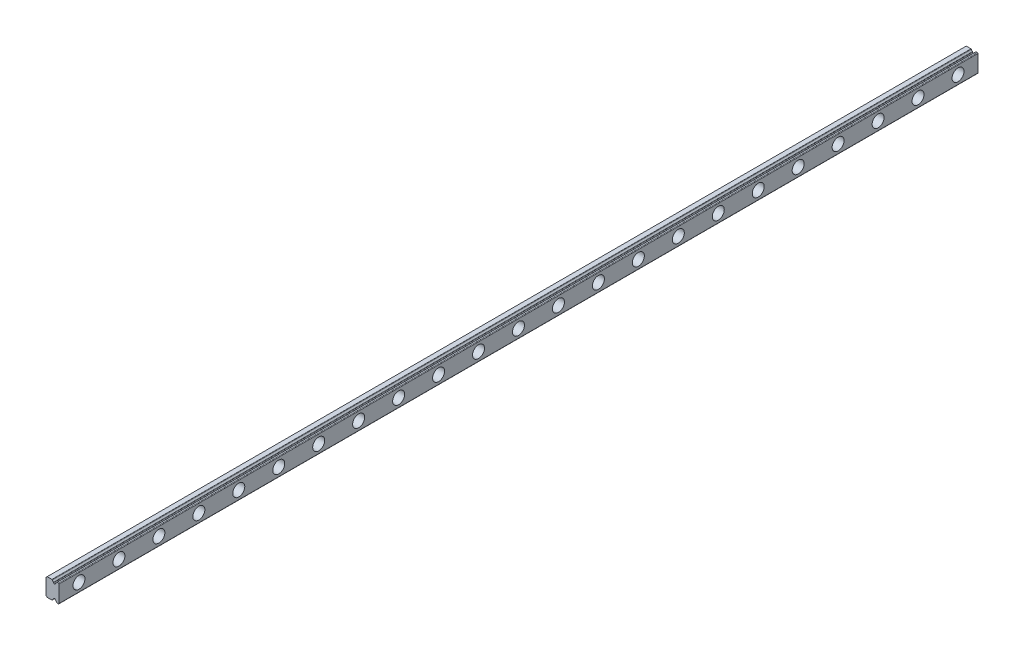
from build123d import *

# Parameters (mm, degrees)
EXTRUDE_1_DEPTH      = 400
SKETCH_2_R           = 3
CUT_EXTRUDE_1_DEPTH  = 4.5
SKETCH_3_R           = 1.75
CUT_EXTRUDE_2_DEPTH  = 401.126542484
CUT_EXTRUDE_4_DEPTH  = 80
EXTRUDE_2_DEPTH      = 200
CUT_EXTRUDE_START    = -100
SKETCH_7_R           = 1.75
CUT_EXTRUDE_5_DEPTH  = 100
SKETCH_8_R           = 3
CUT_EXTRUDE_6_DEPTH  = 4.5
CUT_EXTRUDE_10_DEPTH = 60


with BuildPart() as part:
    # 草图1 → 凸台-拉伸1 (new body)
    with BuildSketch(Plane.XY):
        with BuildLine():
            ThreePointArc((6.2, 9), (6.412132034, 8.912132034), (6.5, 8.7))
            Line((6.5, 8.7), (6.5, 0.3))
            ThreePointArc((6.5, 0.3), (6.412132034, 0.087867966), (6.2, 0))
            Line((6.2, 0), (5.557669683, 0))
            ThreePointArc((5.557669683, 0), (5.444280341, 0.035249106), (5.370859728, 0.128571429))
            ThreePointArc((5.370859728, 0.128571429), (5.130846451, 0.514929157), (4.764285714, 0.784209483))
            ThreePointArc((4.764285714, 0.784209483), (4.680969149, 0.858006567), (4.65, 0.964911064))
            Line((4.65, 0.964911064), (4.65, 1))
            ThreePointArc((4.65, 1), (4.25, 1.4), (3.85, 1))
            Line((3.85, 1), (3.85, 0.964911064))
            ThreePointArc((3.85, 0.964911064), (3.819030851, 0.858006567), (3.735714286, 0.784209483))
            ThreePointArc((3.735714286, 0.784209483), (3.369153549, 0.514929157), (3.129140272, 0.128571429))
            ThreePointArc((3.129140272, 0.128571429), (3.055719659, 0.035249106), (2.942330317, 0))
            Line((2.942330317, 0), (0.6, 0))
            Line((0.6, 0), (0, 0.6))
            Line((0, 0.6), (0, 8.4))
            Line((0, 8.4), (0.6, 9))
            Line((0.6, 9), (2.942330317, 9))
            ThreePointArc((2.942330317, 9), (3.055719659, 8.964750894), (3.129140272, 8.871428571))
            ThreePointArc((3.129140272, 8.871428571), (3.369153549, 8.485070843), (3.735714286, 8.215790517))
            ThreePointArc((3.735714286, 8.215790517), (3.819030851, 8.141993433), (3.85, 8.035088936))
            Line((3.85, 8.035088936), (3.85, 8))
            ThreePointArc((3.85, 8), (4.25, 7.6), (4.65, 8))
            Line((4.65, 8), (4.65, 8.035088936))
            ThreePointArc((4.65, 8.035088936), (4.680969149, 8.141993433), (4.764285714, 8.215790517))
            ThreePointArc((4.764285714, 8.215790517), (5.130846451, 8.485070843), (5.370859728, 8.871428571))
            ThreePointArc((5.370859728, 8.871428571), (5.444280341, 8.964750894), (5.557669683, 9))
            Line((5.557669683, 9), (6.2, 9))
        make_face()
    extrude(amount=EXTRUDE_1_DEPTH)

    # 草图2 → 切除-拉伸1 (cut)
    with BuildSketch(Plane(origin=(6.5, 0, 0), x_dir=(0, 0, -1), z_dir=(1, 0, 0))):
        with Locations((-10, 4.5)):
            Circle(SKETCH_2_R)
        with Locations((-30, 4.5)):
            Circle(SKETCH_2_R)
        with Locations((-50, 4.5)):
            Circle(SKETCH_2_R)
        with Locations((-70, 4.5)):
            Circle(SKETCH_2_R)
        with Locations((-90, 4.5)):
            Circle(SKETCH_2_R)
        with Locations((-110, 4.5)):
            Circle(SKETCH_2_R)
        with Locations((-130, 4.5)):
            Circle(SKETCH_2_R)
        with Locations((-150, 4.5)):
            Circle(SKETCH_2_R)
        with Locations((-170, 4.5)):
            Circle(SKETCH_2_R)
        with Locations((-190, 4.5)):
            Circle(SKETCH_2_R)
        with Locations((-210, 4.5)):
            Circle(SKETCH_2_R)
        with Locations((-230, 4.5)):
            Circle(SKETCH_2_R)
        with Locations((-250, 4.5)):
            Circle(SKETCH_2_R)
        with Locations((-270, 4.5)):
            Circle(SKETCH_2_R)
        with Locations((-290, 4.5)):
            Circle(SKETCH_2_R)
        with Locations((-310, 4.5)):
            Circle(SKETCH_2_R)
        with Locations((-330, 4.5)):
            Circle(SKETCH_2_R)
        with Locations((-350, 4.5)):
            Circle(SKETCH_2_R)
        with Locations((-370, 4.5)):
            Circle(SKETCH_2_R)
        with Locations((-390, 4.5)):
            Circle(SKETCH_2_R)
        with Locations((-410, 4.5)):
            Circle(SKETCH_2_R)
        with Locations((-430, 4.5)):
            Circle(SKETCH_2_R)
        with Locations((-450, 4.5)):
            Circle(SKETCH_2_R)
        with Locations((-470, 4.5)):
            Circle(SKETCH_2_R)
        with Locations((-490, 4.5)):
            Circle(SKETCH_2_R)
        with Locations((-510, 4.5)):
            Circle(SKETCH_2_R)
        with Locations((-530, 4.5)):
            Circle(SKETCH_2_R)
        with Locations((-550, 4.5)):
            Circle(SKETCH_2_R)
        with Locations((-570, 4.5)):
            Circle(SKETCH_2_R)
        with Locations((-590, 4.5)):
            Circle(SKETCH_2_R)
        with Locations((-610, 4.5)):
            Circle(SKETCH_2_R)
        with Locations((-630, 4.5)):
            Circle(SKETCH_2_R)
        with Locations((-650, 4.5)):
            Circle(SKETCH_2_R)
        with Locations((-670, 4.5)):
            Circle(SKETCH_2_R)
        with Locations((-690, 4.5)):
            Circle(SKETCH_2_R)
        with Locations((-710, 4.5)):
            Circle(SKETCH_2_R)
        with Locations((-730, 4.5)):
            Circle(SKETCH_2_R)
        with Locations((-750, 4.5)):
            Circle(SKETCH_2_R)
        with Locations((-770, 4.5)):
            Circle(SKETCH_2_R)
        with Locations((-790, 4.5)):
            Circle(SKETCH_2_R)
        with Locations((-810, 4.5)):
            Circle(SKETCH_2_R)
        with Locations((-830, 4.5)):
            Circle(SKETCH_2_R)
        with Locations((-850, 4.5)):
            Circle(SKETCH_2_R)
        with Locations((-870, 4.5)):
            Circle(SKETCH_2_R)
        with Locations((-890, 4.5)):
            Circle(SKETCH_2_R)
        with Locations((-910, 4.5)):
            Circle(SKETCH_2_R)
        with Locations((-930, 4.5)):
            Circle(SKETCH_2_R)
        with Locations((-950, 4.5)):
            Circle(SKETCH_2_R)
        with Locations((-970, 4.5)):
            Circle(SKETCH_2_R)
        with Locations((-990, 4.5)):
            Circle(SKETCH_2_R)
        with Locations((-1010, 4.5)):
            Circle(SKETCH_2_R)
        with Locations((-1030, 4.5)):
            Circle(SKETCH_2_R)
        with Locations((-1050, 4.5)):
            Circle(SKETCH_2_R)
        with Locations((-1070, 4.5)):
            Circle(SKETCH_2_R)
        with Locations((-1090, 4.5)):
            Circle(SKETCH_2_R)
        with Locations((-1110, 4.5)):
            Circle(SKETCH_2_R)
        with Locations((-1130, 4.5)):
            Circle(SKETCH_2_R)
        with Locations((-1150, 4.5)):
            Circle(SKETCH_2_R)
        with Locations((-1170, 4.5)):
            Circle(SKETCH_2_R)
        with Locations((-1190, 4.5)):
            Circle(SKETCH_2_R)
        with Locations((-1210, 4.5)):
            Circle(SKETCH_2_R)
        with Locations((-1230, 4.5)):
            Circle(SKETCH_2_R)
        with Locations((-1250, 4.5)):
            Circle(SKETCH_2_R)
        with Locations((-1270, 4.5)):
            Circle(SKETCH_2_R)
        with Locations((-1290, 4.5)):
            Circle(SKETCH_2_R)
        with Locations((-1310, 4.5)):
            Circle(SKETCH_2_R)
        with Locations((-1330, 4.5)):
            Circle(SKETCH_2_R)
        with Locations((-1350, 4.5)):
            Circle(SKETCH_2_R)
        with Locations((-1370, 4.5)):
            Circle(SKETCH_2_R)
        with Locations((-1390, 4.5)):
            Circle(SKETCH_2_R)
        with Locations((-1410, 4.5)):
            Circle(SKETCH_2_R)
        with Locations((-1430, 4.5)):
            Circle(SKETCH_2_R)
        with Locations((-1450, 4.5)):
            Circle(SKETCH_2_R)
        with Locations((-1470, 4.5)):
            Circle(SKETCH_2_R)
        with Locations((-1490, 4.5)):
            Circle(SKETCH_2_R)
        with Locations((-1510, 4.5)):
            Circle(SKETCH_2_R)
        with Locations((-1530, 4.5)):
            Circle(SKETCH_2_R)
        with Locations((-1550, 4.5)):
            Circle(SKETCH_2_R)
        with Locations((-1570, 4.5)):
            Circle(SKETCH_2_R)
        with Locations((-1590, 4.5)):
            Circle(SKETCH_2_R)
        with Locations((-1610, 4.5)):
            Circle(SKETCH_2_R)
        with Locations((-1630, 4.5)):
            Circle(SKETCH_2_R)
        with Locations((-1650, 4.5)):
            Circle(SKETCH_2_R)
        with Locations((-1670, 4.5)):
            Circle(SKETCH_2_R)
        with Locations((-1690, 4.5)):
            Circle(SKETCH_2_R)
        with Locations((-1710, 4.5)):
            Circle(SKETCH_2_R)
        with Locations((-1730, 4.5)):
            Circle(SKETCH_2_R)
        with Locations((-1750, 4.5)):
            Circle(SKETCH_2_R)
        with Locations((-1770, 4.5)):
            Circle(SKETCH_2_R)
        with Locations((-1790, 4.5)):
            Circle(SKETCH_2_R)
        with Locations((-1810, 4.5)):
            Circle(SKETCH_2_R)
        with Locations((-1830, 4.5)):
            Circle(SKETCH_2_R)
        with Locations((-1850, 4.5)):
            Circle(SKETCH_2_R)
        with Locations((-1870, 4.5)):
            Circle(SKETCH_2_R)
        with Locations((-1890, 4.5)):
            Circle(SKETCH_2_R)
        with Locations((-1910, 4.5)):
            Circle(SKETCH_2_R)
        with Locations((-1930, 4.5)):
            Circle(SKETCH_2_R)
        with Locations((-1950, 4.5)):
            Circle(SKETCH_2_R)
        with Locations((-1970, 4.5)):
            Circle(SKETCH_2_R)
        with Locations((-1990, 4.5)):
            Circle(SKETCH_2_R)
        with Locations((-2010, 4.5)):
            Circle(SKETCH_2_R)
        with Locations((-2030, 4.5)):
            Circle(SKETCH_2_R)
        with Locations((-2050, 4.5)):
            Circle(SKETCH_2_R)
        with Locations((-2070, 4.5)):
            Circle(SKETCH_2_R)
        with Locations((-2090, 4.5)):
            Circle(SKETCH_2_R)
        with Locations((-2110, 4.5)):
            Circle(SKETCH_2_R)
        with Locations((-2130, 4.5)):
            Circle(SKETCH_2_R)
        with Locations((-2150, 4.5)):
            Circle(SKETCH_2_R)
        with Locations((-2170, 4.5)):
            Circle(SKETCH_2_R)
        with Locations((-2190, 4.5)):
            Circle(SKETCH_2_R)
        with Locations((-2210, 4.5)):
            Circle(SKETCH_2_R)
        with Locations((-2230, 4.5)):
            Circle(SKETCH_2_R)
        with Locations((-2250, 4.5)):
            Circle(SKETCH_2_R)
        with Locations((-2270, 4.5)):
            Circle(SKETCH_2_R)
        with Locations((-2290, 4.5)):
            Circle(SKETCH_2_R)
        with Locations((-2310, 4.5)):
            Circle(SKETCH_2_R)
        with Locations((-2330, 4.5)):
            Circle(SKETCH_2_R)
        with Locations((-2350, 4.5)):
            Circle(SKETCH_2_R)
        with Locations((-2370, 4.5)):
            Circle(SKETCH_2_R)
        with Locations((-2390, 4.5)):
            Circle(SKETCH_2_R)
        with Locations((-2410, 4.5)):
            Circle(SKETCH_2_R)
        with Locations((-2430, 4.5)):
            Circle(SKETCH_2_R)
        with Locations((-2450, 4.5)):
            Circle(SKETCH_2_R)
        with Locations((-2470, 4.5)):
            Circle(SKETCH_2_R)
    extrude(amount=-CUT_EXTRUDE_1_DEPTH, mode=Mode.SUBTRACT)

    # 草图3 → 切除-拉伸2 (cut, through all)
    with BuildSketch(Plane(origin=(2, 0, 0), x_dir=(0, 0, -1), z_dir=(1, 0, 0))):
        with Locations((-10, 4.5)):
            Circle(SKETCH_3_R)
        with Locations((-30, 4.5)):
            Circle(SKETCH_3_R)
        with Locations((-50, 4.5)):
            Circle(SKETCH_3_R)
        with Locations((-70, 4.5)):
            Circle(SKETCH_3_R)
        with Locations((-90, 4.5)):
            Circle(SKETCH_3_R)
        with Locations((-110, 4.5)):
            Circle(SKETCH_3_R)
        with Locations((-130, 4.5)):
            Circle(SKETCH_3_R)
        with Locations((-150, 4.5)):
            Circle(SKETCH_3_R)
        with Locations((-170, 4.5)):
            Circle(SKETCH_3_R)
        with Locations((-190, 4.5)):
            Circle(SKETCH_3_R)
        with Locations((-210, 4.5)):
            Circle(SKETCH_3_R)
        with Locations((-230, 4.5)):
            Circle(SKETCH_3_R)
        with Locations((-250, 4.5)):
            Circle(SKETCH_3_R)
        with Locations((-270, 4.5)):
            Circle(SKETCH_3_R)
        with Locations((-290, 4.5)):
            Circle(SKETCH_3_R)
        with Locations((-310, 4.5)):
            Circle(SKETCH_3_R)
        with Locations((-330, 4.5)):
            Circle(SKETCH_3_R)
        with Locations((-350, 4.5)):
            Circle(SKETCH_3_R)
        with Locations((-370, 4.5)):
            Circle(SKETCH_3_R)
        with Locations((-390, 4.5)):
            Circle(SKETCH_3_R)
        with Locations((-410, 4.5)):
            Circle(SKETCH_3_R)
        with Locations((-430, 4.5)):
            Circle(SKETCH_3_R)
        with Locations((-450, 4.5)):
            Circle(SKETCH_3_R)
        with Locations((-470, 4.5)):
            Circle(SKETCH_3_R)
        with Locations((-490, 4.5)):
            Circle(SKETCH_3_R)
        with Locations((-510, 4.5)):
            Circle(SKETCH_3_R)
        with Locations((-530, 4.5)):
            Circle(SKETCH_3_R)
        with Locations((-550, 4.5)):
            Circle(SKETCH_3_R)
        with Locations((-570, 4.5)):
            Circle(SKETCH_3_R)
        with Locations((-590, 4.5)):
            Circle(SKETCH_3_R)
        with Locations((-610, 4.5)):
            Circle(SKETCH_3_R)
        with Locations((-630, 4.5)):
            Circle(SKETCH_3_R)
        with Locations((-650, 4.5)):
            Circle(SKETCH_3_R)
        with Locations((-670, 4.5)):
            Circle(SKETCH_3_R)
        with Locations((-690, 4.5)):
            Circle(SKETCH_3_R)
        with Locations((-710, 4.5)):
            Circle(SKETCH_3_R)
        with Locations((-730, 4.5)):
            Circle(SKETCH_3_R)
        with Locations((-750, 4.5)):
            Circle(SKETCH_3_R)
        with Locations((-770, 4.5)):
            Circle(SKETCH_3_R)
        with Locations((-790, 4.5)):
            Circle(SKETCH_3_R)
        with Locations((-810, 4.5)):
            Circle(SKETCH_3_R)
        with Locations((-830, 4.5)):
            Circle(SKETCH_3_R)
        with Locations((-850, 4.5)):
            Circle(SKETCH_3_R)
        with Locations((-870, 4.5)):
            Circle(SKETCH_3_R)
        with Locations((-890, 4.5)):
            Circle(SKETCH_3_R)
        with Locations((-910, 4.5)):
            Circle(SKETCH_3_R)
        with Locations((-930, 4.5)):
            Circle(SKETCH_3_R)
        with Locations((-950, 4.5)):
            Circle(SKETCH_3_R)
        with Locations((-970, 4.5)):
            Circle(SKETCH_3_R)
        with Locations((-990, 4.5)):
            Circle(SKETCH_3_R)
        with Locations((-1010, 4.5)):
            Circle(SKETCH_3_R)
        with Locations((-1030, 4.5)):
            Circle(SKETCH_3_R)
        with Locations((-1050, 4.5)):
            Circle(SKETCH_3_R)
        with Locations((-1070, 4.5)):
            Circle(SKETCH_3_R)
    extrude(amount=-CUT_EXTRUDE_2_DEPTH, mode=Mode.SUBTRACT)

    # 草图5 → 切除-拉伸4 (cut)
    with BuildSketch(Plane(origin=(0, 0, 0), x_dir=(-1, 0, 0), z_dir=(0, 0, -1))):
        with BuildLine():
            Line((-6.5, 8.7), (-6.5, 0.3))
            ThreePointArc((-6.5, 0.3), (-6.412132034, 0.087867966), (-6.2, 0))
            Line((-6.2, 0), (-5.557669683, 0))
            ThreePointArc((-5.557669683, 0), (-5.444280341, 0.035249106), (-5.370859728, 0.128571429))
            ThreePointArc((-5.370859728, 0.128571429), (-5.130846451, 0.514929157), (-4.764285714, 0.784209483))
            ThreePointArc((-4.764285714, 0.784209483), (-4.680969149, 0.858006567), (-4.65, 0.964911064))
            Line((-4.65, 0.964911064), (-4.65, 1))
            ThreePointArc((-4.65, 1), (-4.25, 1.4), (-3.85, 1))
            Line((-3.85, 1), (-3.85, 0.964911064))
            ThreePointArc((-3.85, 0.964911064), (-3.819030851, 0.858006567), (-3.735714286, 0.784209483))
            ThreePointArc((-3.735714286, 0.784209483), (-3.369153549, 0.514929157), (-3.129140272, 0.128571429))
            ThreePointArc((-3.129140272, 0.128571429), (-3.055719659, 0.035249106), (-2.942330317, 0))
            Line((-2.942330317, 0), (-0.6, 0))
            Line((-0.6, 0), (0, 0.6))
            Line((0, 0.6), (0, 8.4))
            Line((0, 8.4), (-0.6, 9))
            Line((-0.6, 9), (-2.942330317, 9))
            ThreePointArc((-2.942330317, 9), (-3.055719659, 8.964750894), (-3.129140272, 8.871428571))
            ThreePointArc((-3.129140272, 8.871428571), (-3.369153549, 8.485070843), (-3.735714286, 8.215790517))
            ThreePointArc((-3.735714286, 8.215790517), (-3.819030851, 8.141993433), (-3.85, 8.035088936))
            Line((-3.85, 8.035088936), (-3.85, 8))
            ThreePointArc((-3.85, 8), (-4.25, 7.6), (-4.65, 8))
            Line((-4.65, 8), (-4.65, 8.035088936))
            ThreePointArc((-4.65, 8.035088936), (-4.680969149, 8.141993433), (-4.764285714, 8.215790517))
            ThreePointArc((-4.764285714, 8.215790517), (-5.130846451, 8.485070843), (-5.370859728, 8.871428571))
            ThreePointArc((-5.370859728, 8.871428571), (-5.444280341, 8.964750894), (-5.557669683, 9))
            Line((-5.557669683, 9), (-6.2, 9))
            ThreePointArc((-6.2, 9), (-6.412132034, 8.912132034), (-6.5, 8.7))
        make_face()
    extrude(amount=-CUT_EXTRUDE_4_DEPTH, mode=Mode.SUBTRACT)

    # 草图6 → 凸台-拉伸2 (add)
    with BuildSketch(Plane.XY.offset(400)):
        with BuildLine():
            Line((6.2, 9), (5.557669683, 9))
            ThreePointArc((5.557669683, 9), (5.444280341, 8.964750894), (5.370859728, 8.871428571))
            ThreePointArc((5.370859728, 8.871428571), (5.130846451, 8.485070843), (4.764285714, 8.215790517))
            ThreePointArc((4.764285714, 8.215790517), (4.680969149, 8.141993433), (4.65, 8.035088936))
            Line((4.65, 8.035088936), (4.65, 8))
            ThreePointArc((4.65, 8), (4.25, 7.6), (3.85, 8))
            Line((3.85, 8), (3.85, 8.035088936))
            ThreePointArc((3.85, 8.035088936), (3.819030851, 8.141993433), (3.735714286, 8.215790517))
            ThreePointArc((3.735714286, 8.215790517), (3.369153549, 8.485070843), (3.129140272, 8.871428571))
            ThreePointArc((3.129140272, 8.871428571), (3.055719659, 8.964750894), (2.942330317, 9))
            Line((2.942330317, 9), (0.6, 9))
            Line((0.6, 9), (0, 8.4))
            Line((0, 8.4), (0, 0.6))
            Line((0, 0.6), (0.6, 0))
            Line((0.6, 0), (2.942330317, 0))
            ThreePointArc((2.942330317, 0), (3.055719659, 0.035249106), (3.129140272, 0.128571429))
            ThreePointArc((3.129140272, 0.128571429), (3.369153549, 0.514929157), (3.735714286, 0.784209483))
            ThreePointArc((3.735714286, 0.784209483), (3.819030851, 0.858006567), (3.85, 0.964911064))
            Line((3.85, 0.964911064), (3.85, 1))
            ThreePointArc((3.85, 1), (4.25, 1.4), (4.65, 1))
            Line((4.65, 1), (4.65, 0.964911064))
            ThreePointArc((4.65, 0.964911064), (4.680969149, 0.858006567), (4.764285714, 0.784209483))
            ThreePointArc((4.764285714, 0.784209483), (5.130846451, 0.514929157), (5.370859728, 0.128571429))
            ThreePointArc((5.370859728, 0.128571429), (5.444280341, 0.035249106), (5.557669683, 0))
            Line((5.557669683, 0), (6.2, 0))
            ThreePointArc((6.2, 0), (6.412132034, 0.087867966), (6.5, 0.3))
            Line((6.5, 0.3), (6.5, 8.7))
            ThreePointArc((6.5, 8.7), (6.412132034, 8.912132034), (6.2, 9))
        make_face()
    extrude(amount=EXTRUDE_2_DEPTH)

    # 草图7 → 切除-拉伸5 (cut)
    with BuildSketch(Plane.ZY.offset(CUT_EXTRUDE_START)):
        with Locations(Location((390, 4.5, 0), (0, 0, 180))):
            Circle(SKETCH_7_R)
        with Locations(Location((410, 4.5, 0), (0, 0, 270))):
            Circle(SKETCH_7_R)
        with Locations(Location((430, 4.5, 0), (0, 0, 270))):
            Circle(SKETCH_7_R)
        with Locations(Location((450, 4.5, 0), (0, 0, 270))):
            Circle(SKETCH_7_R)
        with Locations(Location((470, 4.5, 0), (0, 0, 270))):
            Circle(SKETCH_7_R)
        with Locations(Location((490, 4.5, 0), (0, 0, 270))):
            Circle(SKETCH_7_R)
        with Locations(Location((510, 4.5, 0), (0, 0, 270))):
            Circle(SKETCH_7_R)
        with Locations(Location((530, 4.5, 0), (0, 0, 270))):
            Circle(SKETCH_7_R)
        with Locations(Location((550, 4.5, 0), (0, 0, 270))):
            Circle(SKETCH_7_R)
        with Locations(Location((570, 4.5, 0), (0, 0, 270))):
            Circle(SKETCH_7_R)
        with Locations(Location((590, 4.5, 0), (0, 0, 270))):
            Circle(SKETCH_7_R)
    extrude(amount=CUT_EXTRUDE_5_DEPTH, mode=Mode.SUBTRACT)

    # 草图8 → 切除-拉伸6 (cut)
    with BuildSketch(Plane(origin=(6.5, 0, 0), x_dir=(0, 0, -1), z_dir=(1, 0, 0))):
        with Locations((-390, 4.5)):
            Circle(SKETCH_8_R)
        with Locations(Location((-410, 4.5, 0), (0, 0, 90))):
            Circle(SKETCH_8_R)
        with Locations(Location((-430, 4.5, 0), (0, 0, 90))):
            Circle(SKETCH_8_R)
        with Locations(Location((-450, 4.5, 0), (0, 0, 90))):
            Circle(SKETCH_8_R)
        with Locations(Location((-470, 4.5, 0), (0, 0, 90))):
            Circle(SKETCH_8_R)
        with Locations(Location((-490, 4.5, 0), (0, 0, 90))):
            Circle(SKETCH_8_R)
        with Locations(Location((-510, 4.5, 0), (0, 0, 90))):
            Circle(SKETCH_8_R)
        with Locations(Location((-530, 4.5, 0), (0, 0, 90))):
            Circle(SKETCH_8_R)
        with Locations(Location((-550, 4.5, 0), (0, 0, 90))):
            Circle(SKETCH_8_R)
        with Locations(Location((-570, 4.5, 0), (0, 0, 90))):
            Circle(SKETCH_8_R)
        with Locations(Location((-590, 4.5, 0), (0, 0, 90))):
            Circle(SKETCH_8_R)
    extrude(amount=-CUT_EXTRUDE_6_DEPTH, mode=Mode.SUBTRACT)

    # 草图10 → 切除-拉伸10 (cut)
    with BuildSketch(Plane(origin=(0, 0, 80), x_dir=(-1, 0, 0), z_dir=(0, 0, -1))):
        with BuildLine():
            Line((-6.5, 8.7), (-6.5, 0.3))
            ThreePointArc((-6.5, 0.3), (-6.412132034, 0.087867966), (-6.2, 0))
            Line((-6.2, 0), (-5.557669683, 0))
            ThreePointArc((-5.557669683, 0), (-5.444280341, 0.035249106), (-5.370859728, 0.128571429))
            ThreePointArc((-5.370859728, 0.128571429), (-5.130846451, 0.514929157), (-4.764285714, 0.784209483))
            ThreePointArc((-4.764285714, 0.784209483), (-4.680969149, 0.858006567), (-4.65, 0.964911064))
            Line((-4.65, 0.964911064), (-4.65, 1))
            ThreePointArc((-4.65, 1), (-4.25, 1.4), (-3.85, 1))
            Line((-3.85, 1), (-3.85, 0.964911064))
            ThreePointArc((-3.85, 0.964911064), (-3.819030851, 0.858006567), (-3.735714286, 0.784209483))
            ThreePointArc((-3.735714286, 0.784209483), (-3.369153549, 0.514929157), (-3.129140272, 0.128571429))
            ThreePointArc((-3.129140272, 0.128571429), (-3.055719659, 0.035249106), (-2.942330317, 0))
            Line((-2.942330317, 0), (-0.6, 0))
            Line((-0.6, 0), (0, 0.6))
            Line((0, 0.6), (0, 8.4))
            Line((0, 8.4), (-0.6, 9))
            Line((-0.6, 9), (-2.942330317, 9))
            ThreePointArc((-2.942330317, 9), (-3.055719659, 8.964750894), (-3.129140272, 8.871428571))
            ThreePointArc((-3.129140272, 8.871428571), (-3.369153549, 8.485070843), (-3.735714286, 8.215790517))
            ThreePointArc((-3.735714286, 8.215790517), (-3.819030851, 8.141993433), (-3.85, 8.035088936))
            Line((-3.85, 8.035088936), (-3.85, 8))
            ThreePointArc((-3.85, 8), (-4.25, 7.6), (-4.65, 8))
            Line((-4.65, 8), (-4.65, 8.035088936))
            ThreePointArc((-4.65, 8.035088936), (-4.680969149, 8.141993433), (-4.764285714, 8.215790517))
            ThreePointArc((-4.764285714, 8.215790517), (-5.130846451, 8.485070843), (-5.370859728, 8.871428571))
            ThreePointArc((-5.370859728, 8.871428571), (-5.444280341, 8.964750894), (-5.557669683, 9))
            Line((-5.557669683, 9), (-6.2, 9))
            ThreePointArc((-6.2, 9), (-6.412132034, 8.912132034), (-6.5, 8.7))
        make_face()
    extrude(amount=-CUT_EXTRUDE_10_DEPTH, mode=Mode.SUBTRACT)


solid = part.part
